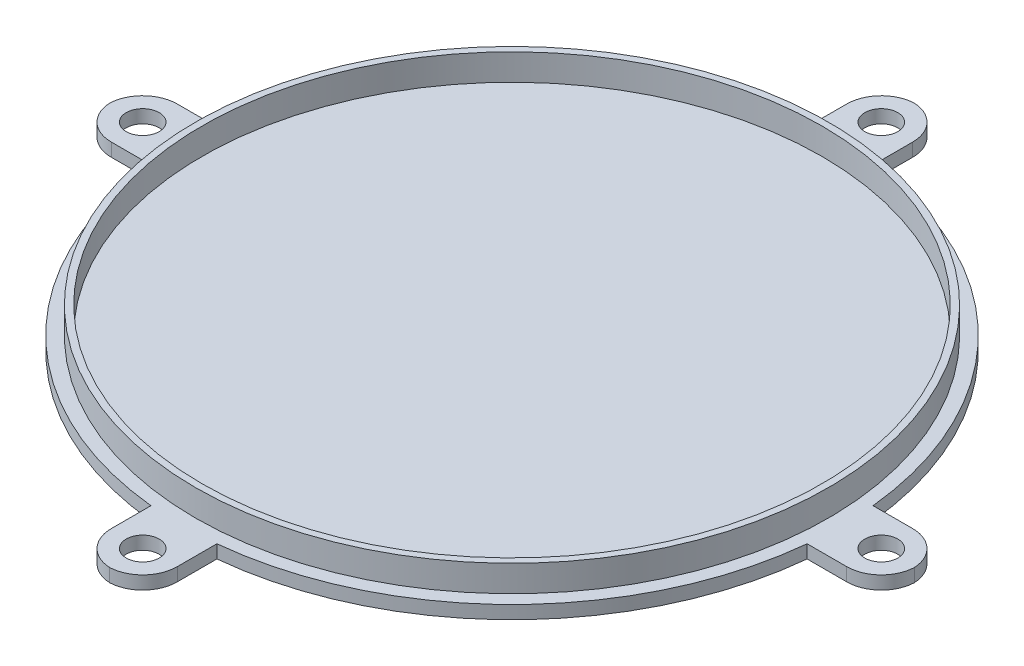
from build123d import *

# Parameters (mm, degrees)
SKETCH1_R           = 50
BOSS_EXTRUDE1_DEPTH = 2
SKETCH2_R           = 48
SKETCH2_R_2         = 47
BOSS_EXTRUDE2_DEPTH = 4
BOSS_EXTRUDE3_START = -2
SKETCH3_R           = 2.5
BOSS_EXTRUDE3_DEPTH = 2


with BuildPart() as part:
    # Sketch1 → Boss-Extrude1 (new body)
    with BuildSketch(Plane(origin=(0, 0, 0), x_dir=(1, 0, 0), z_dir=(0, 1, 0))):
        with Locations(Location((0, 0, 0), (0, 0, 270))):
            Circle(SKETCH1_R)
    extrude(amount=BOSS_EXTRUDE1_DEPTH)

    # Sketch2 → Boss-Extrude2 (add)
    with BuildSketch(Plane(origin=(0, 2, 0), x_dir=(1, 0, 0), z_dir=(0, 1, 0))):
        with Locations(Location((0, 0, 0), (0, 0, 270))):
            Circle(SKETCH2_R)
        with Locations(Location((0, 0, 0), (0, 0, 270))):
            Circle(SKETCH2_R_2, mode=Mode.SUBTRACT)
    extrude(amount=BOSS_EXTRUDE2_DEPTH)

    # Sketch3 → Boss-Extrude3 (add)
    # profile 1 of 4: a face of its own
    with BuildSketch(Plane(origin=(0, 2, 0), x_dir=(1, 0, 0), z_dir=(0, 1, 0)).offset(BOSS_EXTRUDE3_START)):
        with BuildLine():
            Line((-55.759371855, 5), (-49.749371855, 5))
            ThreePointArc((-49.749371855, 5), (-50, 0), (-49.749371855, -5))
            Line((-49.749371855, -5), (-55.759371855, -5))
            ThreePointArc((-55.759371855, -5), (-59.380980039, -3.54948202), (-61, 0))
            ThreePointArc((-61, 0), (-59.380980039, 3.54948202), (-55.759371855, 5))
        make_face()
        with Locations(Location((-56, 0, 0), (0, 0, 270))):
            Circle(SKETCH3_R, mode=Mode.SUBTRACT)
    # profile 2 of 4: a face of its own
    with BuildSketch(Plane(origin=(0, 2, 0), x_dir=(1, 0, 0), z_dir=(0, 1, 0)).offset(BOSS_EXTRUDE3_START)):
        with BuildLine():
            Line((5, 55.759371855), (5, 49.749371855))
            ThreePointArc((5, 49.749371855), (0, 50), (-5, 49.749371855))
            Line((-5, 49.749371855), (-5, 55.759371855))
            ThreePointArc((-5, 55.759371855), (-3.54948202, 59.380980039), (0, 61))
            ThreePointArc((0, 61), (3.54948202, 59.380980039), (5, 55.759371855))
        make_face()
        with Locations(Location((0, 56, 0), (0, 0, 270))):
            Circle(SKETCH3_R, mode=Mode.SUBTRACT)
    # profile 3 of 4: a face of its own
    with BuildSketch(Plane(origin=(0, 2, 0), x_dir=(1, 0, 0), z_dir=(0, 1, 0)).offset(BOSS_EXTRUDE3_START)):
        with BuildLine():
            Line((55.759371855, -5), (49.749371855, -5))
            ThreePointArc((49.749371855, -5), (50, 0), (49.749371855, 5))
            Line((49.749371855, 5), (55.759371855, 5))
            ThreePointArc((55.759371855, 5), (59.380980039, 3.54948202), (61, 0))
            ThreePointArc((61, 0), (59.380980039, -3.54948202), (55.759371855, -5))
        make_face()
        with Locations(Location((56, 0, 0), (0, 0, 270))):
            Circle(SKETCH3_R, mode=Mode.SUBTRACT)
    # profile 4 of 4: a face of its own
    with BuildSketch(Plane(origin=(0, 2, 0), x_dir=(1, 0, 0), z_dir=(0, 1, 0)).offset(BOSS_EXTRUDE3_START)):
        with BuildLine():
            Line((-5, -55.759371855), (-5, -49.749371855))
            ThreePointArc((-5, -49.749371855), (0, -50), (5, -49.749371855))
            Line((5, -49.749371855), (5, -55.759371855))
            ThreePointArc((5, -55.759371855), (3.54948202, -59.380980039), (0, -61))
            ThreePointArc((0, -61), (-3.54948202, -59.380980039), (-5, -55.759371855))
        make_face()
        with Locations(Location((0, -56, 0), (0, 0, 270))):
            Circle(SKETCH3_R, mode=Mode.SUBTRACT)
    extrude(amount=BOSS_EXTRUDE3_DEPTH)


solid = part.part
